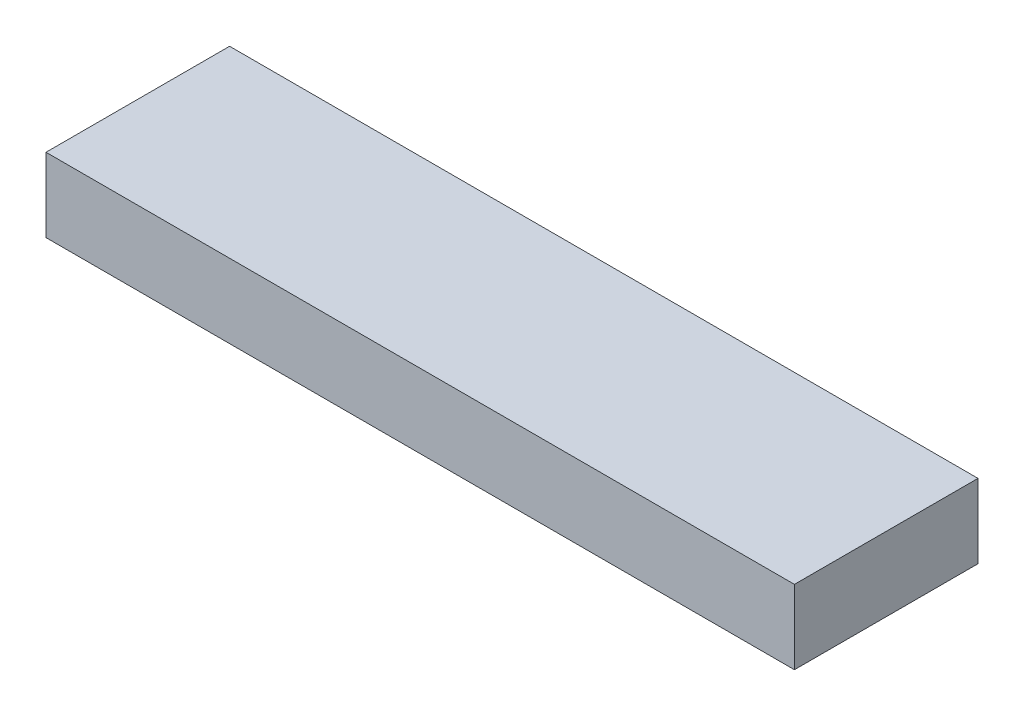
from build123d import *

# Parameters (mm, degrees)
SKETCH1_W           = 31.88
SKETCH1_H           = 7.82
BOSS_EXTRUDE1_DEPTH = 3.15
SHELL1_T            = -1.6
SKETCH2_R           = 1.475
SKETCH2_R_2         = 0.7
BOSS_EXTRUDE2_DEPTH = 1.35


with BuildPart() as part:
    # Sketch1 → Boss-Extrude1 (new body)
    with BuildSketch(Plane(origin=(0, 0, 0), x_dir=(1, 0, 0), z_dir=(0, 1, 0))):
        Rectangle(SKETCH1_W, SKETCH1_H)
    extrude(amount=-BOSS_EXTRUDE1_DEPTH)

    # Shell1
    shell1_openings = [part.faces().sort_by_distance(p)[0] for p in [
        (0, -3.15, 0),
    ]]
    offset(amount=SHELL1_T, openings=shell1_openings, kind=Kind.INTERSECTION)

    # Sketch2 → Boss-Extrude2 (add)
    # profile 1 of 3: a face of its own
    with BuildSketch(Plane.XZ.offset(1.6)):
        with Locations(Location((-7.97, 0, 0), (0, 0, 90))):
            Circle(SKETCH2_R)
        with Locations(Location((-7.97, 0, 0), (0, 0, 90))):
            Circle(SKETCH2_R_2, mode=Mode.SUBTRACT)
    # profile 2 of 3: a face of its own
    with BuildSketch(Plane.XZ.offset(1.6)):
        with Locations(Location((0, 0, 0), (0, 0, 90))):
            Circle(SKETCH2_R)
        with Locations(Location((0, 0, 0), (0, 0, 90))):
            Circle(SKETCH2_R_2, mode=Mode.SUBTRACT)
    # profile 3 of 3: a face of its own
    with BuildSketch(Plane.XZ.offset(1.6)):
        with Locations(Location((7.97, 0, 0), (0, 0, 90))):
            Circle(SKETCH2_R)
        with Locations(Location((7.97, 0, 0), (0, 0, 90))):
            Circle(SKETCH2_R_2, mode=Mode.SUBTRACT)
    extrude(amount=BOSS_EXTRUDE2_DEPTH)


solid = part.part
